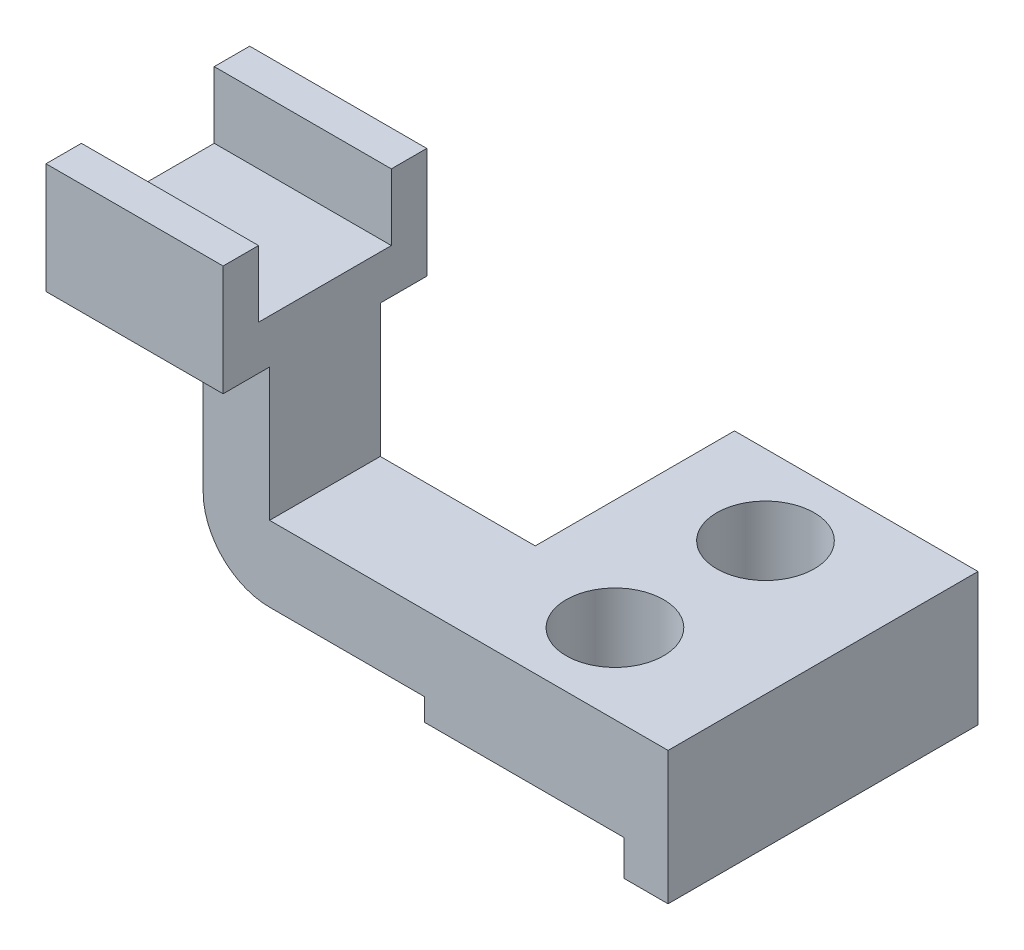
from build123d import *

# Parameters (mm, degrees)
BOSS_EXTRUDE2_DEPTH = 25
BOSS_EXTRUDE3_DEPTH = 45
SKETCH3_W           = 15
SKETCH3_H           = 25
BOSS_EXTRUDE4_DEPTH = 25
SKETCH4_W           = 40
SKETCH4_H           = 30
CUT_EXTRUDE1_DEPTH  = 15
SKETCH5_R           = 11
CUT_EXTRUDE2_DEPTH  = 128.224012634


with BuildPart() as part:
    # Sketch1 → Boss-Extrude2 (new body)
    with BuildSketch(Plane.XY):
        Polygon((29.110234951, -15.315580854), (39.110234951, -15.315580854), (39.110234951, -2.038537921), (39.110234951, 14.698902507), (-50.889765049, 14.698902507), (-50.889765049, -2.301097493), (-15.889765049, -2.301097493), (-15.889765049, -7.315580854), (29.110234951, -7.315580854), align=None)
        with BuildLine():
            Line((-65.889765049, 12.698902507), (-65.889765049, 44.698902507))
            Line((-65.889765049, 44.698902507), (-50.889765049, 44.698902507))
            Line((-50.889765049, 44.698902507), (-50.889765049, 14.698902507))
            Line((-50.889765049, 14.698902507), (-50.889765049, -2.301097493))
            ThreePointArc((-50.889765049, -2.301097493), (-61.496366767, 2.092300789), (-65.889765049, 12.698902507))
        make_face()
    extrude(amount=-BOSS_EXTRUDE2_DEPTH)

    # Sketch2 → Boss-Extrude3 (add)
    with BuildSketch(Plane(origin=(0, 0, -25), x_dir=(-1, 0, 0), z_dir=(0, 0, -1))):
        Polygon((-39.110234951, -15.315580854), (-39.110234951, 14.698902507), (15.889765049, 14.698902507), (15.889765049, -2.301097493), (15.889765049, -7.315580854), (-29.110234951, -7.315580854), (-29.110234951, -15.315580854), align=None)
    extrude(amount=BOSS_EXTRUDE3_DEPTH)

    # Sketch3 → Boss-Extrude4 (add)
    with BuildSketch(Plane(origin=(0, 44.698902507, 0), x_dir=(1, 0, 0), z_dir=(0, 1, 0))):
        Polygon((-50.889765049, 25), (-50.889765049, 35.5), (-90.889765049, 35.5), (-90.889765049, -10.5), (-50.889765049, -10.5), (-50.889765049, 0), (-65.889765049, 0), (-65.889765049, 25), align=None)
        with Locations((-58.389765049, 12.5)):
            Rectangle(SKETCH3_W, SKETCH3_H)
    extrude(amount=BOSS_EXTRUDE4_DEPTH)

    # Sketch4 → Cut-Extrude1 (cut)
    with BuildSketch(Plane(origin=(0, 69.698902507, 0), x_dir=(1, 0, 0), z_dir=(0, 1, 0))):
        with Locations((-70.889765049, 12.5)):
            Rectangle(SKETCH4_W, SKETCH4_H)
    extrude(amount=-CUT_EXTRUDE1_DEPTH, mode=Mode.SUBTRACT)

    # Sketch5 → Cut-Extrude2 (cut, through all)
    with BuildSketch(Plane(origin=(0, 14.698902507, 0), x_dir=(1, 0, 0), z_dir=(0, 1, 0))):
        with Locations(Location((9.110234951, 18, 0), (0, 0, 180))):
            Circle(SKETCH5_R)
        with Locations(Location((9.110234951, 52, 0), (0, 0, 180))):
            Circle(SKETCH5_R)
    extrude(amount=-CUT_EXTRUDE2_DEPTH, mode=Mode.SUBTRACT)


solid = part.part
